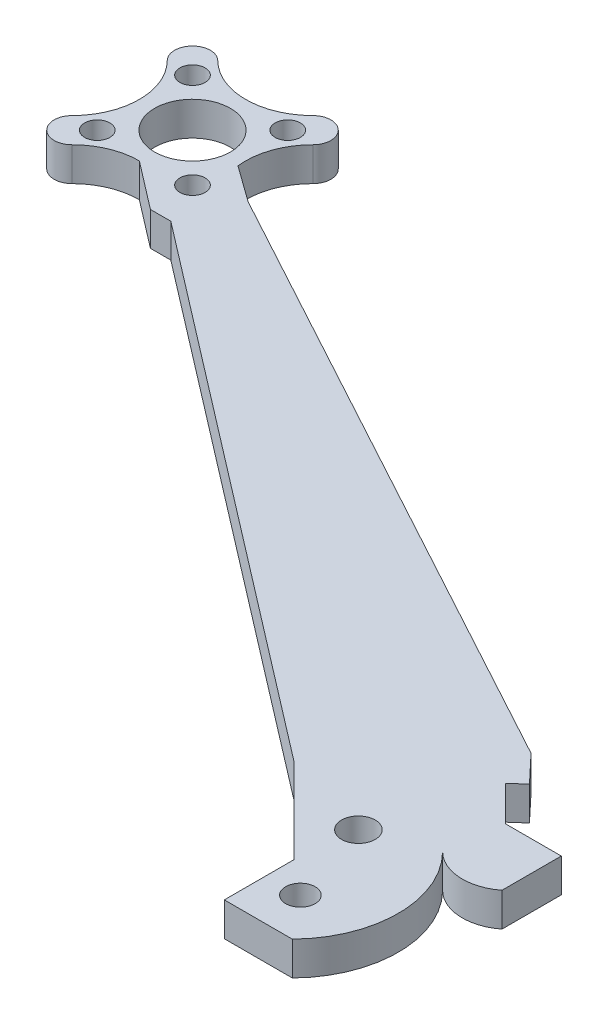
from build123d import *

# Parameters (mm, degrees)
SKETCH1_W            = 16.31
SKETCH1_H            = 16.31
SKETCH1_R            = 4.5
BOSS_EXTRUDE1_DEPTH  = 4
SKETCH3_R            = 1.5
CUT_EXTRUDE1_DEPTH   = 4
BOSS_EXTRUDE2_DEPTH  = 4
BOSS_EXTRUDE6_DEPTH  = 4
CUT_EXTRUDE3_DEPTH   = 4
BOSS_EXTRUDE7_DEPTH  = 4
BOSS_EXTRUDE9_DEPTH  = 4
SKETCH17_OUTSIDE_W   = 136.165
SKETCH17_OUTSIDE_H   = 117.232
CUT_EXTRUDE4_DEPTH   = 4
SKETCH18_R           = 1.5
BOSS_EXTRUDE10_DEPTH = 4
CUT_EXTRUDE5_DEPTH   = 4
SKETCH20_R           = 2
CUT_EXTRUDE6_DEPTH   = 10
SKETCH22_R           = 1.75
CUT_EXTRUDE8_DEPTH   = 124.744497459


with BuildPart() as part:
    # Sketch1 → Boss-Extrude1 (new body)
    with BuildSketch(Plane(origin=(0, 0, 0), x_dir=(1, 0, 0), z_dir=(0, 1, 0))):
        Rectangle(SKETCH1_W, SKETCH1_H)
        with Locations(Location((0, 0, 0), (0, 0, 270))):
            Circle(SKETCH1_R, mode=Mode.SUBTRACT)
    extrude(amount=BOSS_EXTRUDE1_DEPTH)

    # Sketch3 → Cut-Extrude1 (cut)
    with BuildSketch(Plane(origin=(0, 4, 0), x_dir=(1, 0, 0), z_dir=(0, 1, 0))):
        with Locations(Location((5.656854249, 5.656854249, 0), (0, 0, 270))):
            Circle(SKETCH3_R)
        with Locations(Location((5.656854249, -5.656854249, 0), (0, 0, 270))):
            Circle(SKETCH3_R)
        with Locations(Location((-5.656854249, -5.656854249, 0), (0, 0, 270))):
            Circle(SKETCH3_R)
        with Locations(Location((-5.656854249, 5.656854249, 0), (0, 0, 270))):
            Circle(SKETCH3_R)
    extrude(amount=-CUT_EXTRUDE1_DEPTH, mode=Mode.SUBTRACT)

    # Sketch4 → Boss-Extrude2 (add)
    with BuildSketch(Plane(origin=(0, 4, 0), x_dir=(1, 0, 0), z_dir=(0, 1, 0))):
        Polygon((8.155, -8.155), (0, -8.155), (0, -10.655), (10.655, -10.655), (10.655, 0), (8.155, 0), align=None)
    extrude(amount=-BOSS_EXTRUDE2_DEPTH)

    # Sketch9 → Boss-Extrude6 (add)
    with BuildSketch(Plane(origin=(0, 4, 0), x_dir=(1, 0, 0), z_dir=(0, 1, 0))):
        Polygon((71.061407011, -58.982568069), (7.593139788, -10.281653748), (10.613791504, -4.032054751), (84.193483815, -43.982568069), (90.501950314, -50.291034568), (96.061407011, -50.291034568), (96.061407011, -73.982568069), (81.061407011, -73.982568069), (81.061407011, -68.982568069), align=None)
    extrude(amount=-BOSS_EXTRUDE6_DEPTH)

    # Sketch12 → Cut-Extrude3 (cut)
    with BuildSketch(Plane(origin=(0, 4, 0), x_dir=(1, 0, 0), z_dir=(0, 1, 0))):
        Polygon((87.278639473, -47.258318902), (85.780514725, -48.583317861), (89.960889469, -52.761034568), (90.501950314, -52.761034568), (96.061407011, -52.761034568), (96.061407011, -50.291034568), (90.501950314, -50.291034568), (87.347717064, -47.136801318), align=None)
    extrude(amount=-CUT_EXTRUDE3_DEPTH, mode=Mode.SUBTRACT)

    # Sketch13 → Boss-Extrude7 (add)
    with BuildSketch(Plane(origin=(0, 4, 0), x_dir=(1, 0, 0), z_dir=(0, 1, 0))):
        Polygon((81.061407011, -73.982568069), (81.061407011, -77.282568069), (96.561407011, -77.282568069), (96.561407011, -52.761034568), (96.061407011, -52.761034568), (96.061407011, -73.982568069), align=None)
    extrude(amount=-BOSS_EXTRUDE7_DEPTH)

    # Sketch16 → Boss-Extrude9 (add)
    with BuildSketch(Plane(origin=(0, 4, 0), x_dir=(1, 0, 0), z_dir=(0, 1, 0))):
        Polygon((0, -10.655), (-10, -10.655), (-10, 10.345), (10.655, 10.345), (10.655, 0), (8.155, 0), (8.155, 8.155), (-8.155, 8.155), (-8.155, -8.155), (0, -8.155), align=None)
    extrude(amount=-BOSS_EXTRUDE9_DEPTH)

    # Sketch17 outside → Cut-Extrude4 (cut)
    with BuildSketch(Plane(origin=(0, 4, 0), x_dir=(1, 0, 0), z_dir=(0, 1, 0))):
        with Locations((43.2805, -33.469)):
            Rectangle(SKETCH17_OUTSIDE_W, SKETCH17_OUTSIDE_H)
        with BuildLine():
            Line((5.656854249, -8.656854249), (5.656854249, -10.655))
            Line((5.656854249, -10.655), (8.079694096, -10.655))
            Line((8.079694096, -10.655), (71.061407011, -58.982568069))
            Line((71.061407011, -58.982568069), (81.061407011, -68.982568069))
            Line((81.061407011, -68.982568069), (81.061407011, -77.282568069))
            Line((81.061407011, -77.282568069), (96.561407011, -77.282568069))
            Line((96.561407011, -77.282568069), (96.561407011, -52.761034568))
            Line((96.561407011, -52.761034568), (89.960889469, -52.761034568))
            Line((89.960889469, -52.761034568), (85.780514725, -48.583317861))
            Line((85.780514725, -48.583317861), (87.278639473, -47.258318902))
            Line((87.278639473, -47.258318902), (84.193483815, -43.982568069))
            Line((84.193483815, -43.982568069), (10.655, -4.054429139))
            Line((10.655, -4.054429139), (8.656854249, -5.656854249))
            ThreePointArc((8.656854249, -5.656854249), (6.313708499, 0), (8.656854249, 5.656854249))
            ThreePointArc((8.656854249, 5.656854249), (8.656854249, 8.656854249), (5.656854249, 8.656854249))
            ThreePointArc((5.656854249, 8.656854249), (0, 6.313708499), (-5.656854249, 8.656854249))
            ThreePointArc((-5.656854249, 8.656854249), (-8.656854249, 8.656854249), (-8.656854249, 5.656854249))
            ThreePointArc((-8.656854249, 5.656854249), (-6.313708499, 0), (-8.656854249, -5.656854249))
            ThreePointArc((-8.656854249, -5.656854249), (-8.656854249, -8.656854249), (-5.656854249, -8.656854249))
            ThreePointArc((-5.656854249, -8.656854249), (0, -6.313708499), (5.656854249, -8.656854249))
        make_face(mode=Mode.SUBTRACT)
    extrude(amount=-CUT_EXTRUDE4_DEPTH, mode=Mode.SUBTRACT)

    # Sketch18 → Boss-Extrude10 (add)
    with BuildSketch(Plane(origin=(0, 4, 0), x_dir=(1, 0, 0), z_dir=(0, 1, 0))):
        Polygon((5.656854249, -10.655), (0, -6.313708499), (6.372805828, -0.97060021), (10.655, -4.054429139), (8.656854249, -5.656854249), align=None)
        with Locations(Location((5.656854249, -5.656854249, 0), (0, 0, 270))):
            Circle(SKETCH18_R, mode=Mode.SUBTRACT)
    extrude(amount=-BOSS_EXTRUDE10_DEPTH)

    # Sketch19 → Cut-Extrude5 (cut)
    with BuildSketch(Plane(origin=(0, 4, 0), x_dir=(1, 0, 0), z_dir=(0, 1, 0))):
        with BuildLine():
            Line((97.061407011, -77.355955856), (97.061407011, -59.355955856))
            ThreePointArc((97.061407011, -59.355955856), (93.061407011, -61.012810105), (89.061407011, -59.355955856))
            ThreePointArc((89.061407011, -59.355955856), (92.789329073, -68.355955856), (89.061407011, -77.355955856))
            Line((89.061407011, -77.355955856), (97.061407011, -77.355955856))
        make_face()
    extrude(amount=-CUT_EXTRUDE5_DEPTH, mode=Mode.SUBTRACT)

    # Sketch20 → Cut-Extrude6 (cut)
    with BuildSketch(Plane.XZ):
        with Locations(Location((81.807805677, 62.103797793, 0), (0, 0, 270))):
            Circle(SKETCH20_R)
    extrude(amount=-CUT_EXTRUDE6_DEPTH, mode=Mode.SUBTRACT)

    # Sketch22 → Cut-Extrude8 (cut, through all)
    with BuildSketch(Plane.XZ):
        with Locations(Location((85.097804106, 72.282568069, 0), (0, 0, 270))):
            Circle(SKETCH22_R)
    extrude(amount=-CUT_EXTRUDE8_DEPTH, mode=Mode.SUBTRACT)


solid = part.part
